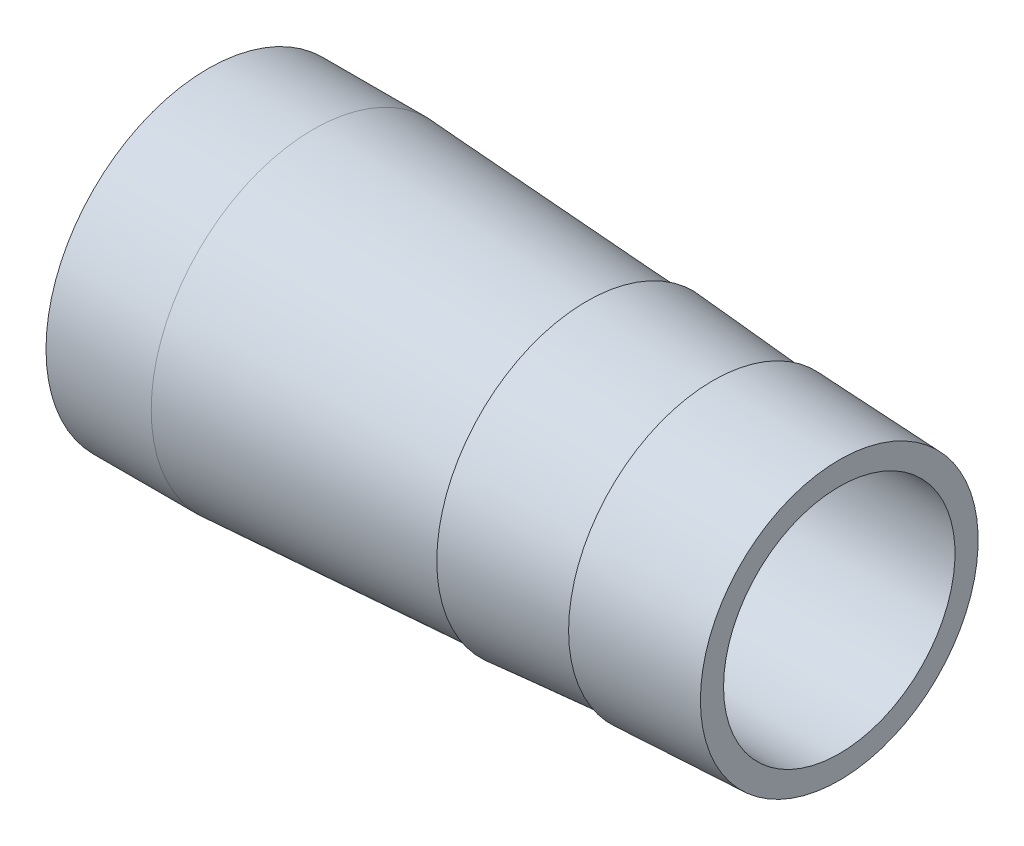
from build123d import *


with BuildPart() as part:
    # Sketch1 → Revolve1 (revolve)
    with BuildSketch(Plane.XY, mode=Mode.PRIVATE) as revolve1_sk:
        Polygon((7.025749102, 6.864), (13.025749102, 6.6), (13.025749102, 5.5), (-11.974250898, 5.5), (-16.974250898, 5.5), (-16.974250898, 7.7), (-11.974250898, 7.7), (1.025749102, 6.932992963), (1.025749102, 7.128), (7.025749102, 6.663732898), align=None)
    revolve(revolve1_sk.sketch.rotate(Axis((-17.994281734, 0, 0), (1, 0, 0)), 90), axis=Axis((-17.994281734, 0, 0), (1, 0, 0)))


solid = part.part
